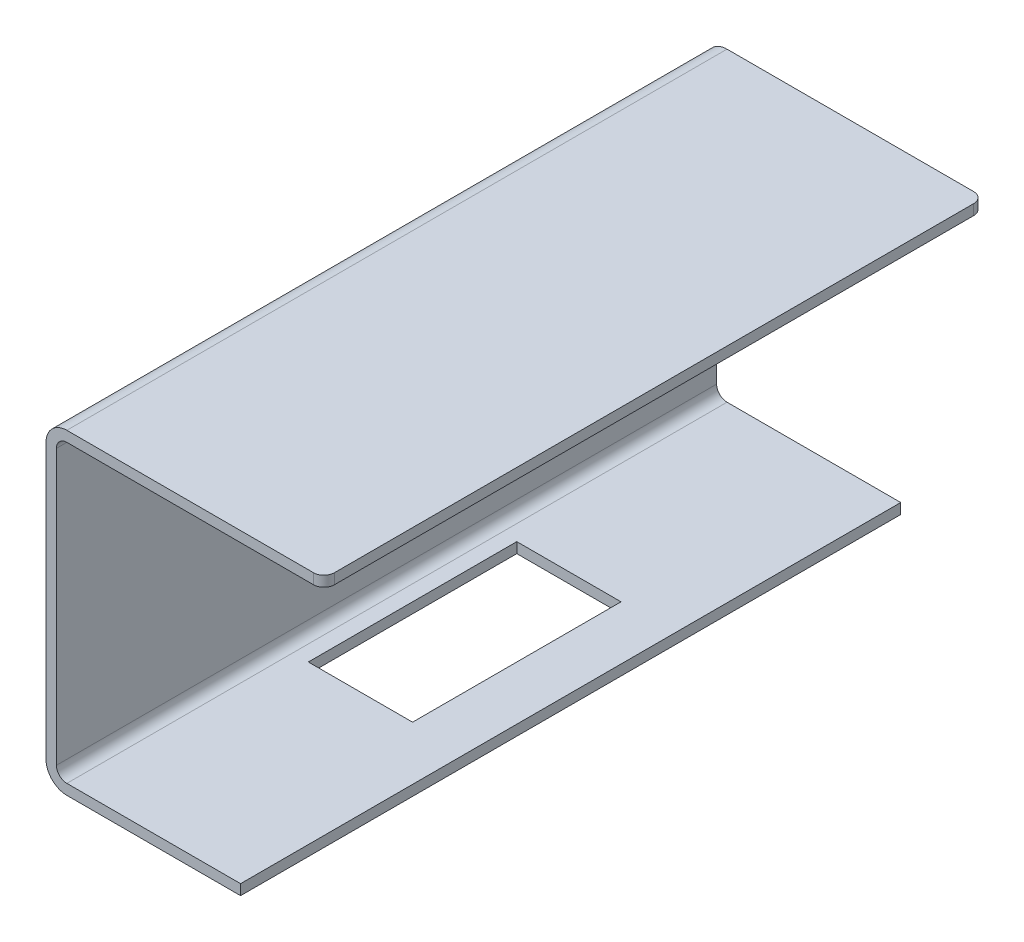
from build123d import *

# Parameters (mm, degrees)
BOSS_EXTRUDE1_DEPTH = 95
FILLET2_R           = 3
CUT_EXTRUDE2_REACH  = 154.43
CUT_EXTRUDE4_REACH  = 154.214
SKETCH7_W           = 30
SKETCH7_H           = 60
CUT_EXTRUDE5_REACH  = 154.43
SKETCH2_R           = 3


with BuildPart() as part:
    # Sketch1 → Boss-Extrude1 (new, symmetric)
    with BuildSketch(Plane.XY):
        with BuildLine():
            Line((6, 91), (80, 91))
            Line((80, 91), (80, 88))
            Line((80, 88), (6, 88))
            ThreePointArc((6, 88), (3.878679656, 87.121320344), (3, 85))
            Line((3, 85), (3, 6))
            ThreePointArc((3, 6), (3.878679656, 3.878679656), (6, 3))
            Line((6, 3), (56, 3))
            Line((56, 3), (56, 0))
            Line((56, 0), (6, 0))
            ThreePointArc((6, 0), (1.757359313, 1.757359313), (0, 6))
            Line((0, 6), (0, 85))
            ThreePointArc((0, 85), (1.757359313, 89.242640687), (6, 91))
        make_face()
    extrude(amount=BOSS_EXTRUDE1_DEPTH, both=True)

    # Fillet2
    fillet2_edges = [part.edges().sort_by_distance(p)[0] for p in [
        (80, 89.5, 95),
        (80, 89.5, -95),
    ]]
    fillet(fillet2_edges, radius=FILLET2_R)

    # Sketch5 → Cut-Extrude2 (cut, up to next)
    with BuildSketch(Plane(origin=(3, 0, 0), x_dir=(0, 0, -1), z_dir=(1, 0, 0)), mode=Mode.PRIVATE) as cut_extrude2_sk1:
        with BuildLine():
            Line((-12.5, 54), (12.5, 54))
            ThreePointArc((12.5, 54), (20, 46.5), (12.5, 39))
            Line((12.5, 39), (-12.5, 39))
            ThreePointArc((-12.5, 39), (-20, 46.5), (-12.5, 54))
        make_face()
    cut_extrude2_tool1 = extrude(cut_extrude2_sk1.sketch, amount=-CUT_EXTRUDE2_REACH, mode=Mode.PRIVATE) & part.part
    add(cut_extrude2_tool1.solids().sort_by_distance((3, 46.5, 0))[0], mode=Mode.SUBTRACT)

    # Sketch7 → Cut-Extrude4 (cut, up to next)
    with BuildSketch(Plane(origin=(0, 3, 0), x_dir=(1, 0, 0), z_dir=(0, 1, 0)), mode=Mode.PRIVATE) as cut_extrude4_sk1:
        with Locations((25.5, 0)):
            Rectangle(SKETCH7_W, SKETCH7_H)
    cut_extrude4_tool1 = extrude(cut_extrude4_sk1.sketch, amount=-CUT_EXTRUDE4_REACH, mode=Mode.PRIVATE) & part.part
    add(cut_extrude4_tool1.solids().sort_by_distance((25.5, 3, 0))[0], mode=Mode.SUBTRACT)

    # Sketch2 → Cut-Extrude5 (cut, up to next)
    with BuildSketch(Plane(origin=(3, 0, 0), x_dir=(0, 0, -1), z_dir=(1, 0, 0)), mode=Mode.PRIVATE) as cut_extrude5_sk1:
        with Locations((-17.5, 21)):
            Circle(SKETCH2_R)
    cut_extrude5_tool1 = extrude(cut_extrude5_sk1.sketch, amount=-CUT_EXTRUDE5_REACH, mode=Mode.PRIVATE) & part.part
    # Sketch2 → Cut-Extrude5 (cut, up to next)
    with BuildSketch(Plane(origin=(3, 0, 0), x_dir=(0, 0, -1), z_dir=(1, 0, 0)), mode=Mode.PRIVATE) as cut_extrude5_sk2:
        with Locations((17.5, 21)):
            Circle(SKETCH2_R)
    cut_extrude5_tool2 = extrude(cut_extrude5_sk2.sketch, amount=-CUT_EXTRUDE5_REACH, mode=Mode.PRIVATE) & part.part
    add(cut_extrude5_tool1.solids().sort_by_distance((3, 21, 17.5))[0], mode=Mode.SUBTRACT)
    add(cut_extrude5_tool2.solids().sort_by_distance((3, 21, -17.5))[0], mode=Mode.SUBTRACT)


solid = part.part
